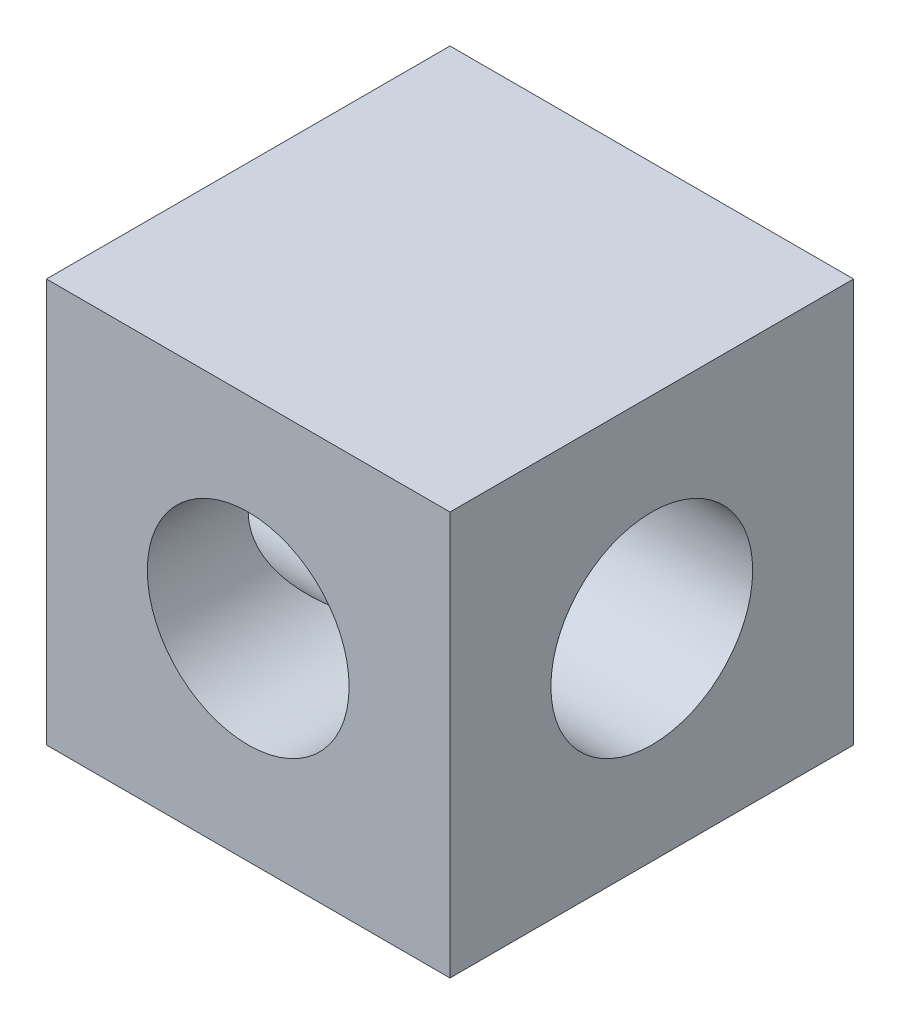
from build123d import *

# Parameters (mm, degrees)
SKETCH1_W           = 200
SKETCH1_H           = 200
BOSS_EXTRUDE1_DEPTH = 200
SKETCH2_R           = 50
CUT_EXTRUDE2_DEPTH  = 210
SKETCH4_R           = 50
CUT_EXTRUDE3_DEPTH  = 100


with BuildPart() as part:
    # Sketch1 → Boss-Extrude1 (new body)
    with BuildSketch(Plane(origin=(0, 0, 0), x_dir=(1, 0, 0), z_dir=(0, 1, 0))):
        with Locations((38.271604938, -41.975308642)):
            Rectangle(SKETCH1_W, SKETCH1_H)
    extrude(amount=BOSS_EXTRUDE1_DEPTH)

    # Sketch2 → Cut-Extrude2 (cut)
    with BuildSketch(Plane.ZY.offset(61.728395062)):
        with Locations((41.975308642, 100)):
            Circle(SKETCH2_R)
    extrude(amount=-CUT_EXTRUDE2_DEPTH, mode=Mode.SUBTRACT)

    # Sketch4 → Cut-Extrude3 (cut)
    with BuildSketch(Plane.XY.offset(141.975308642)):
        with Locations((38.271604938, 100)):
            Circle(SKETCH4_R)
    extrude(amount=-CUT_EXTRUDE3_DEPTH, mode=Mode.SUBTRACT)


solid = part.part
